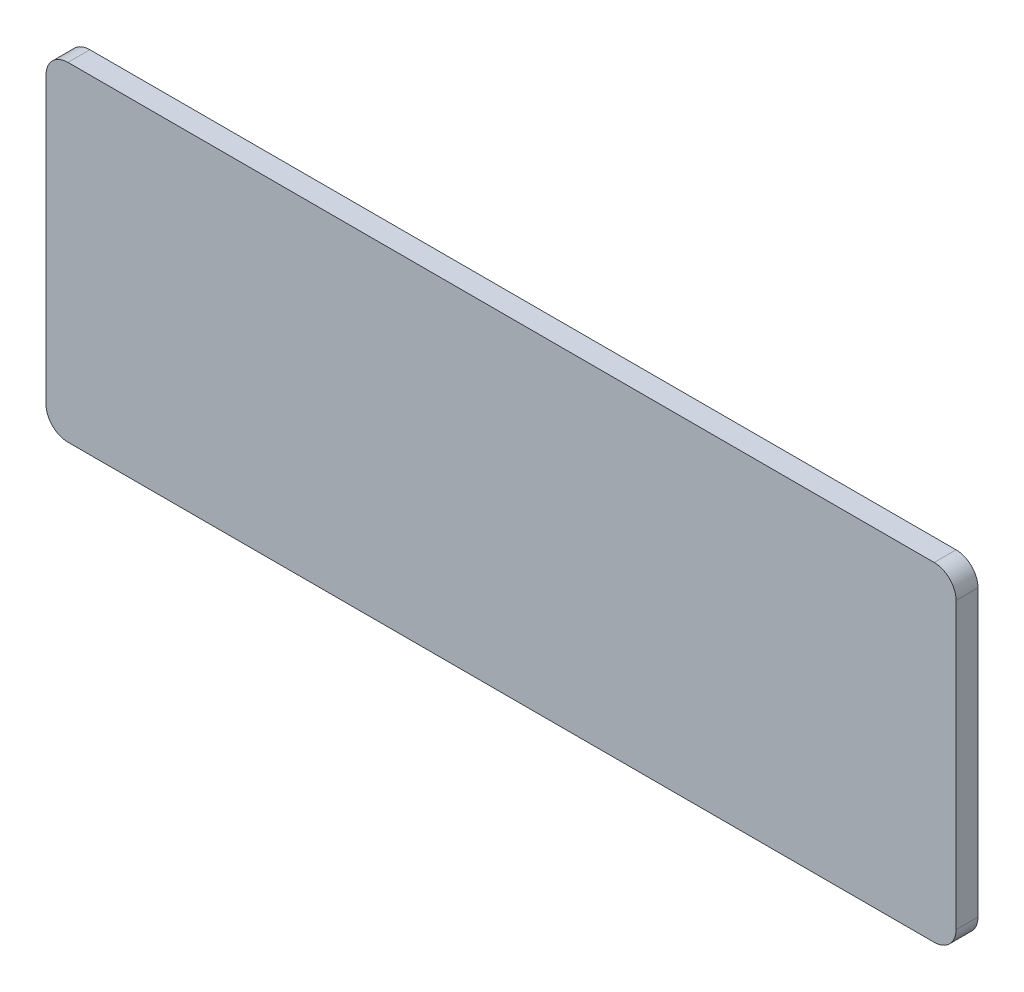
from build123d import *

# Parameters (mm, degrees)
BOSS_EXTRUDE1_DEPTH = 10


with BuildPart() as part:
    # Sketch1 → Boss-Extrude1 (new body)
    with BuildSketch(Plane.XY):
        with BuildLine():
            Line((205, 60), (-190, 60))
            ThreePointArc((-190, 60), (-197.071067812, 57.071067812), (-200, 50))
            Line((-200, 50), (-200, -80))
            ThreePointArc((-200, -80), (-197.071067812, -87.071067812), (-190, -90))
            Line((-190, -90), (205, -90))
            ThreePointArc((205, -90), (212.071067812, -87.071067812), (215, -80))
            Line((215, -80), (215, 50))
            ThreePointArc((215, 50), (212.071067812, 57.071067812), (205, 60))
        make_face()
    extrude(amount=BOSS_EXTRUDE1_DEPTH)


solid = part.part
